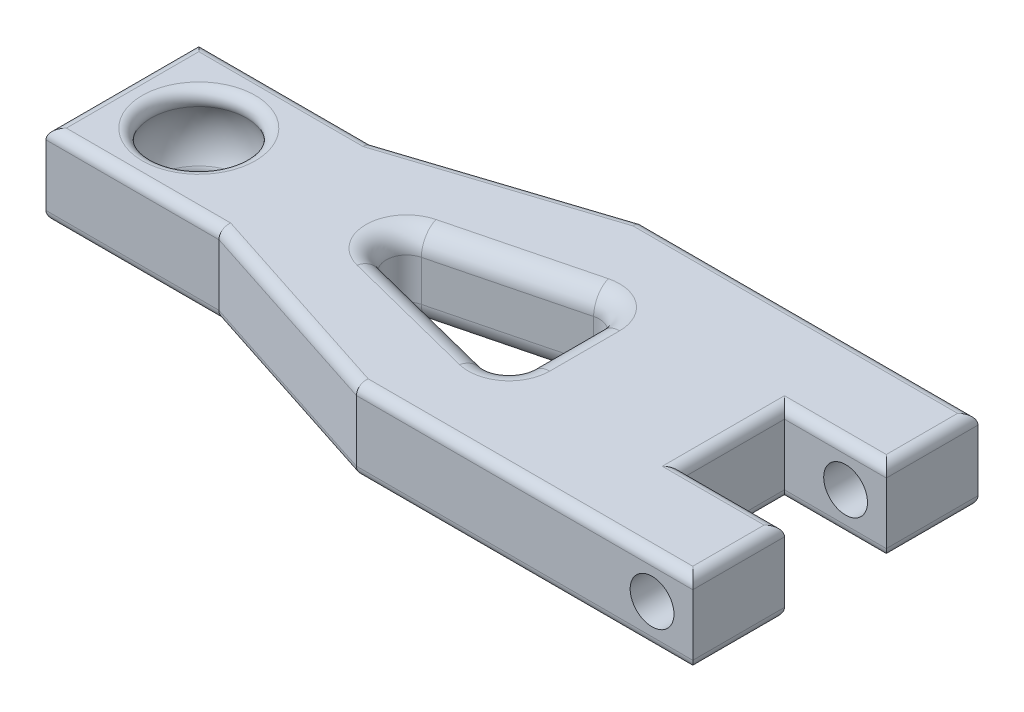
from build123d import *

# Parameters (mm, degrees)
SKETCH1_W           = 70
SKETCH1_H           = 28
BOSS_EXTRUDE1_DEPTH = 8
SKETCH2_W           = 10
SKETCH2_H           = 10
CUT_EXTRUDE1_DEPTH  = 10
SKETCH3_R           = 2.15
CUT_EXTRUDE2_DEPTH  = 46.530209751
SKETCH5_W           = 16.977623655
SKETCH5_H           = 6.5
CUT_EXTRUDE4_DEPTH  = 39.535697736
FILLET1_R           = 1
CUT_EXTRUDE5_DEPTH  = 10
FILLET2_R           = 2


with BuildPart() as part:
    # Sketch1 → Boss-Extrude1 (new body)
    with BuildSketch(Plane(origin=(0, 0, 0), x_dir=(1, 0, 0), z_dir=(0, 1, 0))):
        Rectangle(SKETCH1_W, SKETCH1_H)
    extrude(amount=BOSS_EXTRUDE1_DEPTH)

    # Sketch2 → Cut-Extrude1 (cut)
    with BuildSketch(Plane(origin=(0, 8, 0), x_dir=(1, 0, 0), z_dir=(0, 1, 0))):
        with Locations((30, 0)):
            Rectangle(SKETCH2_W, SKETCH2_H)
    extrude(amount=-CUT_EXTRUDE1_DEPTH, mode=Mode.SUBTRACT)

    # Sketch3 → Cut-Extrude2 (cut, through all)
    with BuildSketch(Plane.XY.offset(14)):
        with Locations((31, 4)):
            Circle(SKETCH3_R)
    extrude(amount=-CUT_EXTRUDE2_DEPTH, mode=Mode.SUBTRACT)

    # Sketch5 → Cut-Extrude4 (cut, through all)
    with BuildSketch(Plane(origin=(0, 8, 0), x_dir=(1, 0, 0), z_dir=(0, 1, 0))):
        with Locations((-26.511188172, 10.75)):
            Rectangle(SKETCH5_W, SKETCH5_H)
        Polygon((-18.022376345, 14), (-18.022376345, 7.5), (1.977623655, 14), align=None)
        Polygon((1.977623655, -14), (-18.022376345, -7.5), (-18.022376345, -14), align=None)
        with Locations((-26.511188172, -10.75)):
            Rectangle(SKETCH5_W, SKETCH5_H)
    extrude(amount=-CUT_EXTRUDE4_DEPTH, mode=Mode.SUBTRACT)

    # Sketch6 → Cut-Revolve1 (revolve, cut)
    with BuildSketch(Plane.XY):
        with BuildLine():
            Line((-31, 8), (-27.5, 8))
            Line((-27.5, 8), (-27.5, 0))
            Line((-27.5, 0), (-31, 0))
            ThreePointArc((-31, 0), (-32.815072906, 4), (-31, 8))
        make_face()
    revolve(axis=Axis((-27.5, 8, 0), (0, -1, 0)), mode=Mode.SUBTRACT)

    # Fillet1
    fillet1_edges = [part.edges().sort_by_distance(p)[0] for p in [
        (35, 0, -9.5),
        (30, 0, -5),
        (25, 0, 0),
        (30, 0, 5),
        (35, 8, -9.5),
        (30, 8, -5),
        (25, 8, 0),
        (30, 8, 5),
        (18.488811828, 0, 14),
        (-35, 0, 0),
        (-35, 8, 0),
        (18.488811828, 8, 14),
        (35, 8, 9.5),
        (-26.511188172, 0, -7.5),
        (-8.022376345, 0, -10.75),
        (-26.511188172, 8, -7.5),
        (-8.022376345, 8, -10.75),
        (18.488811828, 0, -14),
        (-8.022376345, 8, 10.75),
        (-26.511188172, 8, 7.5),
        (-8.022376345, 0, 10.75),
        (35, 0, 9.5),
        (-26.511188172, 0, 7.5),
        (-24, 0, 0),
        (-24, 8, 0),
        (18.488811828, 8, -14),
    ]]
    fillet(fillet1_edges, radius=FILLET1_R)

    # Sketch7 → Cut-Extrude5 (cut)
    with BuildSketch(Plane(origin=(0, 8, 0), x_dir=(1, 0, 0), z_dir=(0, 1, 0))):
        Polygon((-15.216541459, 0), (8.390933297, -6), (8.390933297, 6), align=None)
    extrude(amount=-CUT_EXTRUDE5_DEPTH, mode=Mode.SUBTRACT)

    # Fillet2
    fillet2_edges = [part.edges().sort_by_distance(p)[0] for p in [
        (-3.412804081, 0, 3),
        (8.390933297, 0, 0),
        (-3.412804081, 0, -3),
        (-15.216541459, 4, 0),
        (8.390933297, 4, -6),
        (8.390933297, 4, 6),
        (-3.412804081, 8, -3),
        (-3.412804081, 8, 3),
        (8.390933297, 8, 0),
    ]]
    fillet(fillet2_edges, radius=FILLET2_R)


solid = part.part
